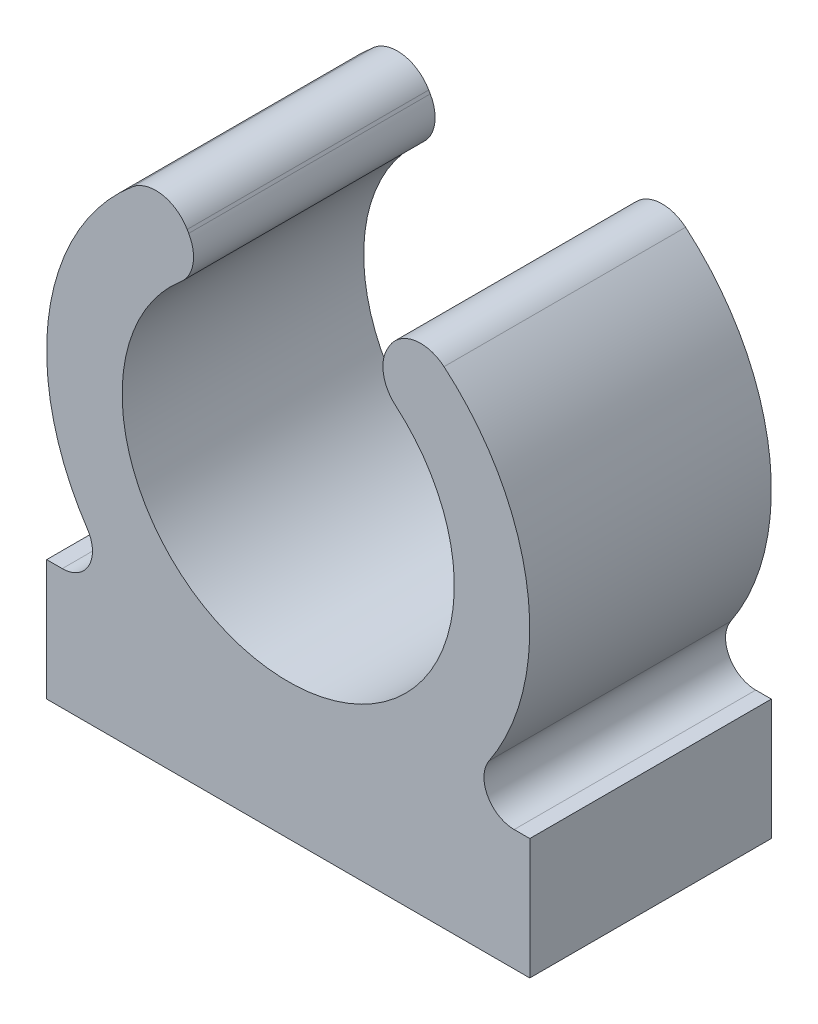
from build123d import *

# Parameters (mm, degrees)
SKETCH_1_W      = 8
SKETCH_1_H      = 4
EXTRUDE_1_DEPTH = 1
EXTRUDE_2_DEPTH = 4
SKETCH_1_2_W    = 8
SKETCH_1_2_H    = 4
EXTRUDE_3_DEPTH = 2
FILLET_1_R      = 0.5


with BuildPart() as part:
    # 草图1 → 凸台-拉伸1 (new body)
    with BuildSketch(Plane(origin=(0, 0, 0), x_dir=(1, 0, 0), z_dir=(0, 1, 0))):
        with Locations((4, 2)):
            Rectangle(SKETCH_1_W, SKETCH_1_H)
    extrude(amount=EXTRUDE_1_DEPTH)



with BuildPart() as body_2:
    # 草图2 → 凸台-拉伸2 (new body)
    with BuildSketch(Plane.XY):
        with BuildLine():
            ThreePointArc((5.779316158, 7.096791361), (6.581537937, 4.052285972), (4, 2.25))
            Line((4, 2.25), (4, 1))
            ThreePointArc((4, 1), (7.756805699, 3.626533239), (6.579923877, 8.056794529))
            ThreePointArc((6.579923877, 8.056794529), (6.089593434, 8.189308732), (5.673320053, 7.898275349))
            Line((5.673320053, 7.898275349), (5.64791535, 7.854273112))
            ThreePointArc((5.64791535, 7.854273112), (5.57635944, 7.451722303), (5.779316158, 7.096791361))
        make_face()
        with BuildLine():
            ThreePointArc((2.220683842, 7.096791361), (2.42364056, 7.451722303), (2.35208465, 7.854273112))
            Line((2.35208465, 7.854273112), (2.326679947, 7.898275349))
            ThreePointArc((2.326679947, 7.898275349), (1.910406566, 8.189308732), (1.420076123, 8.056794529))
            ThreePointArc((1.420076123, 8.056794529), (0.243194301, 3.626533239), (4, 1))
            Line((4, 1), (4, 2.25))
            ThreePointArc((4, 2.25), (1.418462063, 4.052285972), (2.220683842, 7.096791361))
        make_face()
    extrude(amount=-EXTRUDE_2_DEPTH)


with BuildPart() as part_1:
    add(part.part)

    add(body_2.part)  # 凸台-拉伸3 merges body 2
    # 草图1<2> → 凸台-拉伸3 (add)
    with BuildSketch(Plane(origin=(0, 0, 0), x_dir=(1, 0, 0), z_dir=(0, 1, 0))):
        with Locations((4, 2)):
            Rectangle(SKETCH_1_2_W, SKETCH_1_2_H)
    extrude(amount=EXTRUDE_3_DEPTH)

    # 圆角1
    fillet_1_edges = [part_1.edges().sort_by_distance(p)[0] for p in [
        (1.354248689, 2, -2),
        (6.645751311, 2, -2),
    ]]
    fillet(fillet_1_edges, radius=FILLET_1_R)


solid = part_1.part
